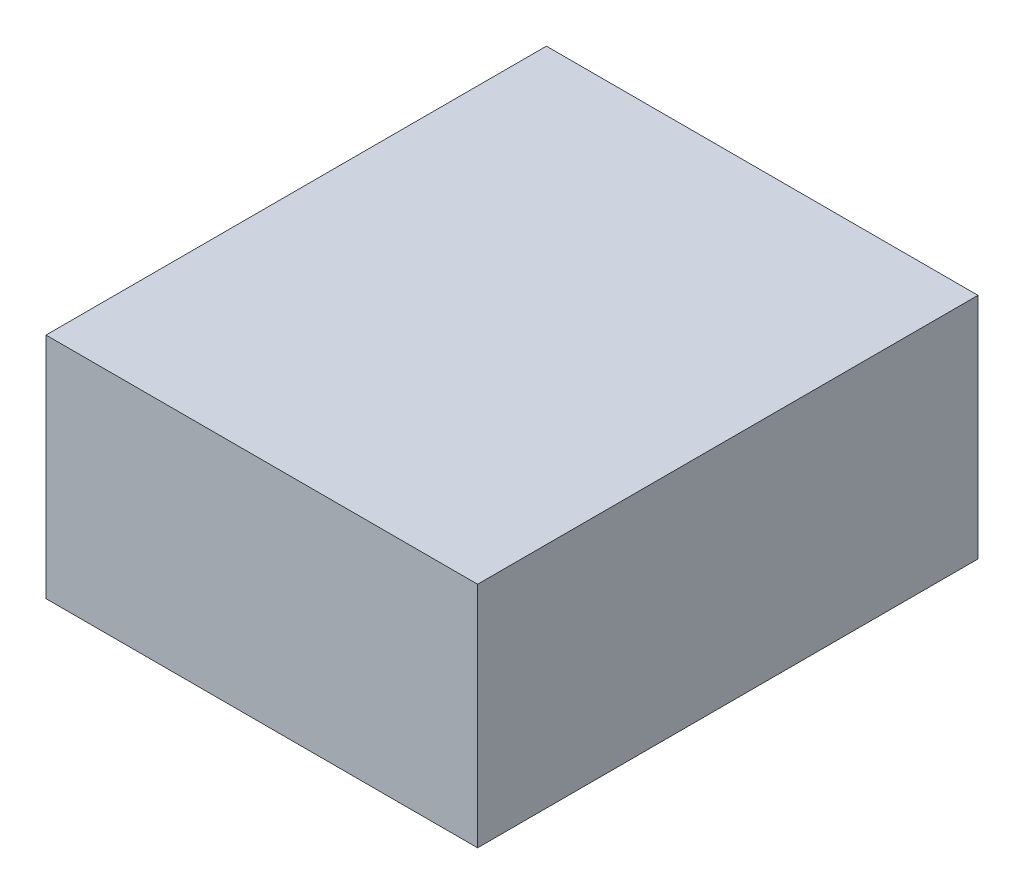
from build123d import *

# Parameters (mm, degrees)
BOSS_EXTRUDE1_DEPTH = 508
BOSS_EXTRUDE2_DEPTH = 3.175
SKETCH3_W           = 438.15
SKETCH3_H           = 231.775
BOSS_EXTRUDE3_DEPTH = 3.175


with BuildPart() as part:
    # Sketch1 → Boss-Extrude1 (new body)
    with BuildSketch(Plane.XY):
        Polygon((0, 0), (3.175, 0), (3.175, 101.6), (434.975, 101.6), (434.975, -127), (438.15, -127), (438.15, 104.775), (0, 104.775), align=None)
    extrude(amount=BOSS_EXTRUDE1_DEPTH)

    # Sketch2 → Boss-Extrude2 (add)
    with BuildSketch(Plane.ZY):
        with BuildLine():
            Line((139.7, -76.2), (165.1, -76.2))
            Line((165.1, -76.2), (165.1, -127))
            Line((165.1, -127), (508, -127))
            Line((508, -127), (508, -76.2))
            Line((508, -76.2), (508, 0))
            Line((508, 0), (63.5, 0))
            ThreePointArc((63.5, 0), (117.381536726, -22.318463274), (139.7, -76.2))
        make_face()
    extrude(amount=-BOSS_EXTRUDE2_DEPTH)

    # Sketch3 → Boss-Extrude3 (add)
    with BuildSketch(Plane.XY.offset(508)):
        with Locations((219.075, -11.1125)):
            Rectangle(SKETCH3_W, SKETCH3_H)
    extrude(amount=-BOSS_EXTRUDE3_DEPTH)


solid = part.part
